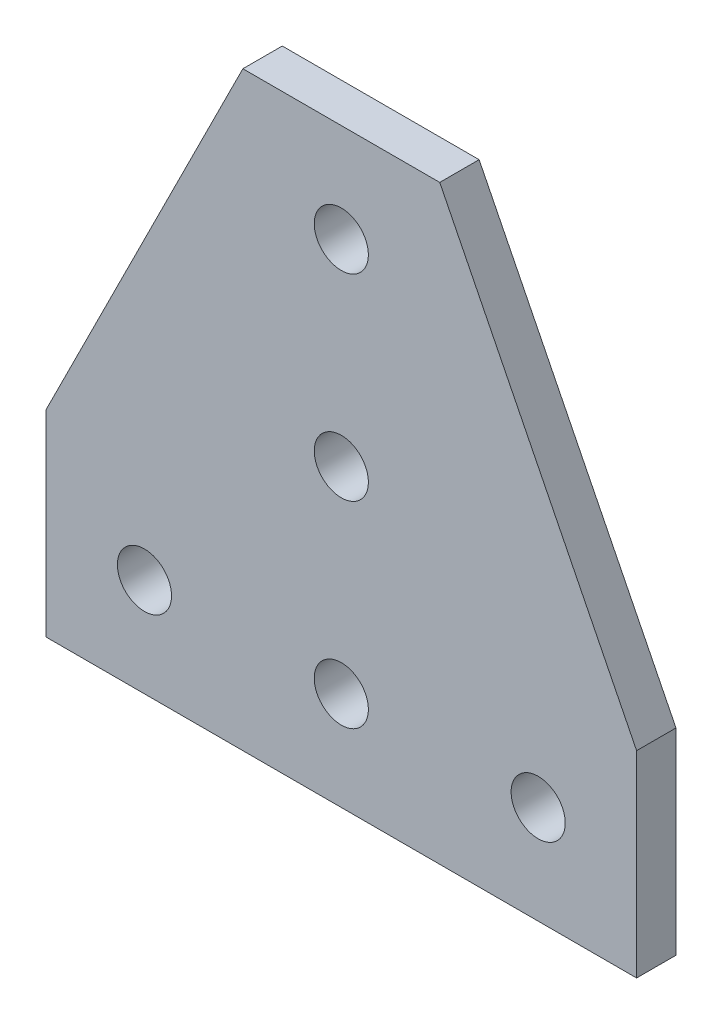
from build123d import *

# Parameters (mm, degrees)
SKETCH1_R           = 2.75
BOSS_EXTRUDE1_DEPTH = 2


with BuildPart() as part:
    # Sketch1 → Boss-Extrude1 (new, symmetric)
    with BuildSketch(Plane.XY):
        Polygon((0, 0), (0, 20), (20, 60), (40, 60), (60, 20), (60, 0), align=None)
        with Locations((10, 10)):
            Circle(SKETCH1_R, mode=Mode.SUBTRACT)
        with Locations((30, 10)):
            Circle(SKETCH1_R, mode=Mode.SUBTRACT)
        with Locations((50, 10)):
            Circle(SKETCH1_R, mode=Mode.SUBTRACT)
        with Locations((30, 30)):
            Circle(SKETCH1_R, mode=Mode.SUBTRACT)
        with Locations((30, 50)):
            Circle(SKETCH1_R, mode=Mode.SUBTRACT)
    extrude(amount=BOSS_EXTRUDE1_DEPTH, both=True)


solid = part.part
